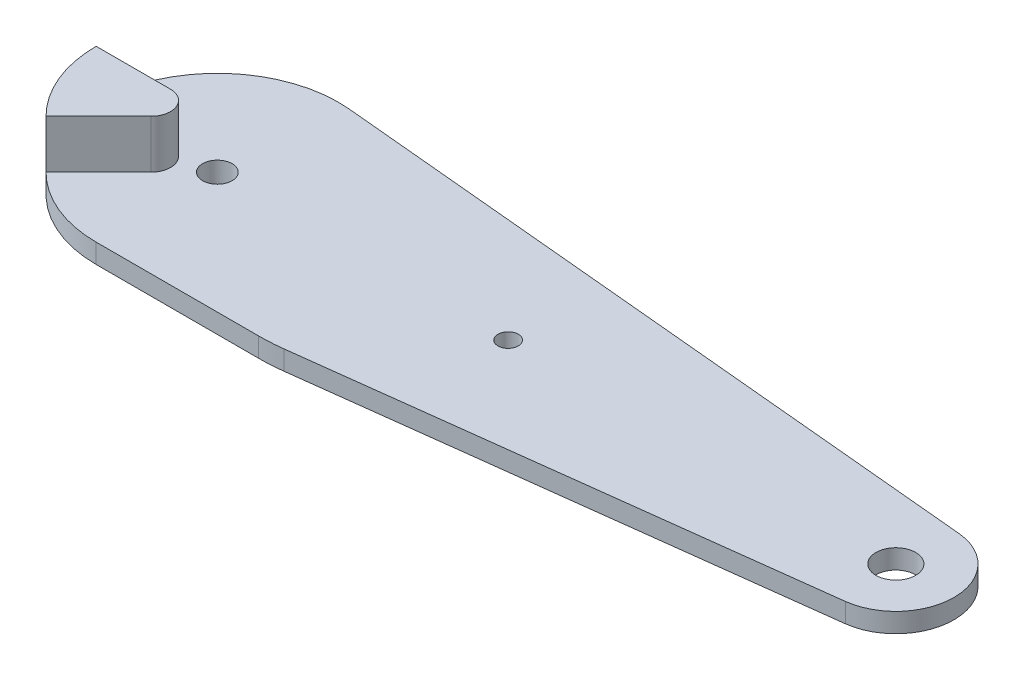
from build123d import *

# Parameters (mm, degrees)
SKETCH_1_R          = 12.5
SKETCH_1_R_2        = 3.05
EXTRUDE_1_DEPTH     = 8
SKETCH_2_R          = 1.6
CUT_EXTRUDE_4_DEPTH = 12.5
SKETCH_3_R          = 4.1
SKETCH_3_R_2        = 2.1
EXTRUDE_2_DEPTH     = 4
SKETCH_4_R          = 18
EXTRUDE_3_DEPTH     = 2
FILLET_2_R          = 40
FILLET_1_R          = 1
EXTRUDE_4_DEPTH     = 10
FILLET_3_R          = 4
SKETCH_6_R          = 3.05
CUT_EXTRUDE_5_DEPTH = 12
CUT_EXTRUDE_6_REACH = 157.605


with BuildPart() as part:
    # 草图1 → 凸台-拉伸1 (new body)
    with BuildSketch(Plane(origin=(0, 0, 0), x_dir=(1, 0, 0), z_dir=(0, 1, 0))):
        with Locations(Location((0, 0, 0), (0, 0, 270))):
            Circle(SKETCH_1_R)
        with Locations(Location((0, 0, 0), (0, 0, 270))):
            Circle(SKETCH_1_R_2, mode=Mode.SUBTRACT)
    extrude(amount=EXTRUDE_1_DEPTH)

    # 草图2 → 切除-拉伸4 (cut, symmetric)
    with BuildSketch(Plane.XY):
        with Locations((0, 3.3)):
            Circle(SKETCH_2_R)
    extrude(amount=CUT_EXTRUDE_4_DEPTH, both=True, mode=Mode.SUBTRACT)

    # 草图3 → 凸台-拉伸2 (add)
    with BuildSketch(Plane(origin=(0, 8, 0), x_dir=(1, 0, 0), z_dir=(0, 1, 0))):
        with BuildLine():
            Line((2.321428571, 24.891986047), (141.114285714, 11.948153303))
            ThreePointArc((141.114285714, 11.948153303), (151.998605375, 0.182945465), (141.478035479, -11.908627592))
            Line((141.478035479, -11.908627592), (36, -25))
            Line((36, -25), (0, -25))
            ThreePointArc((0, -25), (-24.972981912, 1.161970054), (2.321428571, 24.891986047))
        make_face()
        with Locations(Location((140, 0, 0), (0, 0, 270))):
            Circle(SKETCH_3_R, mode=Mode.SUBTRACT)
        with Locations(Location((60, 0, 0), (0, 0, 270))):
            Circle(SKETCH_3_R_2, mode=Mode.SUBTRACT)
    extrude(amount=EXTRUDE_2_DEPTH)

    # 草图4 → 凸台-拉伸3 (add)
    with BuildSketch(Plane.XZ.offset(-8)):
        with Locations(Location((0, 0, 0), (0, 0, 270))):
            Circle(SKETCH_4_R)
    extrude(amount=EXTRUDE_3_DEPTH)

    # 圆角2
    fillet_2_edges = [part.edges().sort_by_distance(p)[0] for p in [
        (36, 10, 25),
    ]]
    fillet(fillet_2_edges, radius=FILLET_2_R)

    # 圆角1
    fillet_1_edges = [part.edges().sort_by_distance(p)[0] for p in [
        (0, 6, 18),
    ]]
    fillet(fillet_1_edges, radius=FILLET_1_R)

    # 草图5 → 凸台-拉伸4 (add)
    with BuildSketch(Plane(origin=(0, 12, 0), x_dir=(1, 0, 0), z_dir=(0, 1, 0))):
        with BuildLine():
            Line((0, 0), (-25, 0))
            ThreePointArc((-25, 0), (-23.096988313, -9.567085809), (-17.67766953, -17.67766953))
            Line((-17.67766953, -17.67766953), (0, 0))
        make_face()
    extrude(amount=EXTRUDE_4_DEPTH)

    # 圆角3
    fillet_3_edges = [part.edges().sort_by_distance(p)[0] for p in [
        (0, 17, 0),
    ]]
    fillet(fillet_3_edges, radius=FILLET_3_R)

    # 草图6 → 切除-拉伸5 (cut)
    with BuildSketch(Plane.XZ):
        with Locations(Location((0, 0, 0), (0, 0, 270))):
            Circle(SKETCH_6_R)
    extrude(amount=-CUT_EXTRUDE_5_DEPTH, mode=Mode.SUBTRACT)

    # 切除-拉伸6: up to this face of the body (flat: up to its plane)
    cut_extrude_6_end = Plane(part.part.faces().sort_by_distance((0, 6, 16.519167389))[0])
    # 草图7 → 切除-拉伸6 (cut, up to the picked face)
    with BuildSketch(Plane.XZ, mode=Mode.PRIVATE) as cut_extrude_6_sk1:
        with BuildLine():
            ThreePointArc((5.937171044, 11), (0, 12.5), (-5.937171044, 11))
            Line((-5.937171044, 11), (5.937171044, 11))
        make_face()
    cut_extrude_6_tool1 = split(extrude(cut_extrude_6_sk1.sketch, amount=-CUT_EXTRUDE_6_REACH, mode=Mode.PRIVATE), bisect_by=cut_extrude_6_end, keep=Keep.BOTH, mode=Mode.PRIVATE)
    # 草图7 → 切除-拉伸6 (cut, up to the picked face)
    with BuildSketch(Plane.XZ, mode=Mode.PRIVATE) as cut_extrude_6_sk2:
        with BuildLine():
            Line((5.937171044, -11), (-5.937171044, -11))
            ThreePointArc((-5.937171044, -11), (0, -12.5), (5.937171044, -11))
        make_face()
    cut_extrude_6_tool2 = split(extrude(cut_extrude_6_sk2.sketch, amount=-CUT_EXTRUDE_6_REACH, mode=Mode.PRIVATE), bisect_by=cut_extrude_6_end, keep=Keep.BOTH, mode=Mode.PRIVATE)
    add(cut_extrude_6_tool1.solids().sort_by(Axis((0, 0, 11.603197), (0, 1, 0)))[0], mode=Mode.SUBTRACT)
    add(cut_extrude_6_tool2.solids().sort_by(Axis((0, 0, -11.603197), (0, 1, 0)))[0], mode=Mode.SUBTRACT)


solid = part.part
